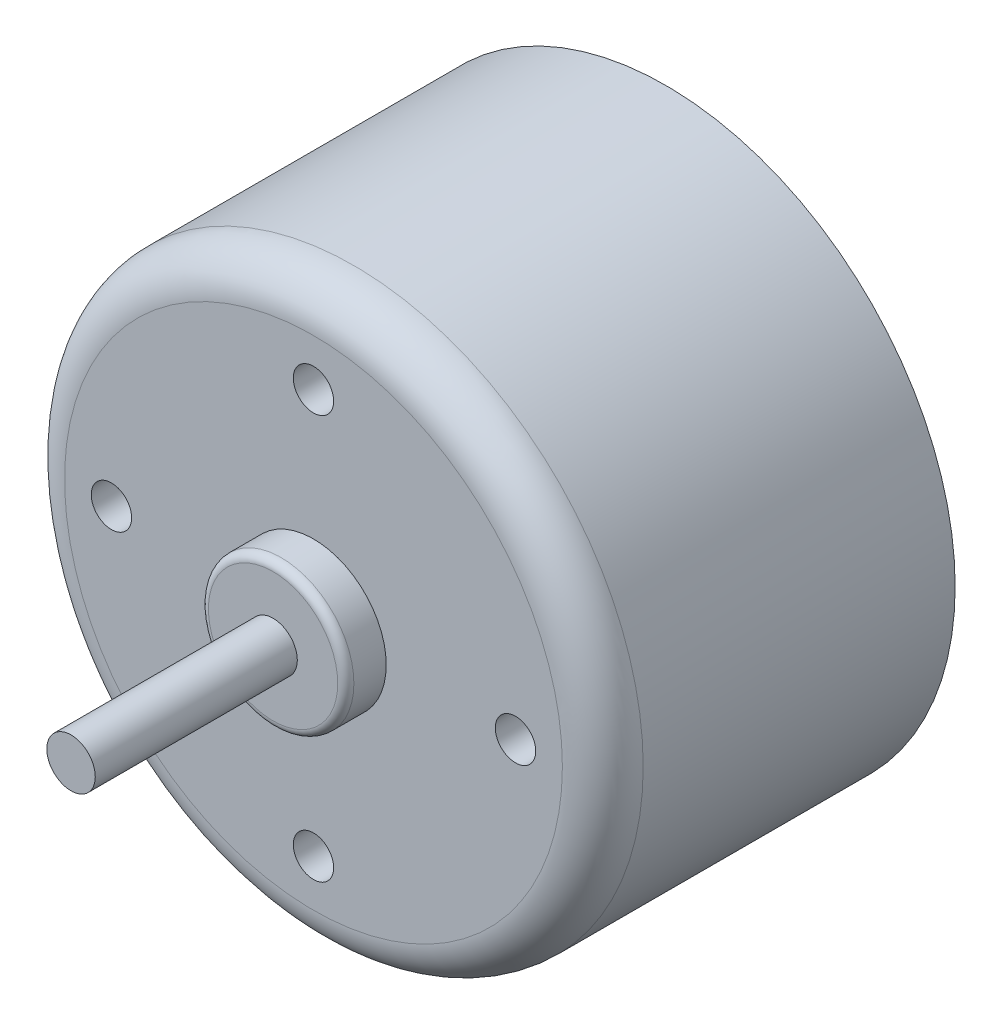
from build123d import *

# Parameters (mm, degrees)
SKETCH1_R                 = 17.9
BOSS_EXTRUDE1_DEPTH       = 21.8
FILLET1_R                 = 2.5
SKETCH2_R                 = 4.5
BOSS_EXTRUDE2_DEPTH       = 2.5
FILLET2_R                 = 0.5
M3X0_5_TAPPED_HOLE1_D     = 2.5
M3X0_5_TAPPED_HOLE1_DEPTH = 7.62
M3X0_5_TAPPED_HOLE1_TIP   = 0.751075774
SKETCH5_R                 = 1.5
BOSS_EXTRUDE3_DEPTH       = 12.5
SKETCH6_R                 = 6.35
BOSS_EXTRUDE4_DEPTH       = 2
BOSS_EXTRUDE5_START       = 1
SKETCH7_R                 = 1.5
BOSS_EXTRUDE5_DEPTH       = 1


with BuildPart() as part:
    # Sketch1 → Boss-Extrude1 (new body)
    with BuildSketch(Plane.XY):
        Circle(SKETCH1_R)
    extrude(amount=BOSS_EXTRUDE1_DEPTH)

    # Fillet1
    fillet1_edges = [part.edges().sort_by_distance(p)[0] for p in [
        (-17.9, 0, 21.8),
    ]]
    fillet(fillet1_edges, radius=FILLET1_R)

    # Sketch2 → Boss-Extrude2 (add)
    with BuildSketch(Plane.XY.offset(21.8)):
        Circle(SKETCH2_R)
    extrude(amount=BOSS_EXTRUDE2_DEPTH)

    # Fillet2
    fillet2_edges = [part.edges().sort_by_distance(p)[0] for p in [
        (-4.5, 0, 24.3),
    ]]
    fillet(fillet2_edges, radius=FILLET2_R)

    # M3x0.5 Tapped Hole1
    with Locations(Plane.XY.offset(21.8)):
        with Locations((0, 12.5), (0, -12.5), (12.5, 0), (-12.5, 0)):
            Hole(M3X0_5_TAPPED_HOLE1_D / 2, depth=M3X0_5_TAPPED_HOLE1_DEPTH)
            with Locations((0, 0, -(M3X0_5_TAPPED_HOLE1_DEPTH + M3X0_5_TAPPED_HOLE1_TIP / 2))):  # 118° drill point
                Cone(0, M3X0_5_TAPPED_HOLE1_D / 2, M3X0_5_TAPPED_HOLE1_TIP, mode=Mode.SUBTRACT)

    # Sketch5 → Boss-Extrude3 (add)
    with BuildSketch(Plane.XY.offset(24.3)):
        Circle(SKETCH5_R)
    extrude(amount=BOSS_EXTRUDE3_DEPTH)

    # Sketch6 → Boss-Extrude4 (add)
    with BuildSketch(Plane(origin=(0, 0, 0), x_dir=(-1, 0, 0), z_dir=(0, 0, -1))):
        Circle(SKETCH6_R)
    extrude(amount=BOSS_EXTRUDE4_DEPTH)

    # Sketch7 → Boss-Extrude5 (add)
    with BuildSketch(Plane(origin=(0, 0, -2), x_dir=(-1, 0, 0), z_dir=(0, 0, -1)).offset(BOSS_EXTRUDE5_START)):
        with Locations(Location((0, 0, 0), (0, 0, 180))):
            Circle(SKETCH7_R)
    extrude(amount=-BOSS_EXTRUDE5_DEPTH)


solid = part.part
